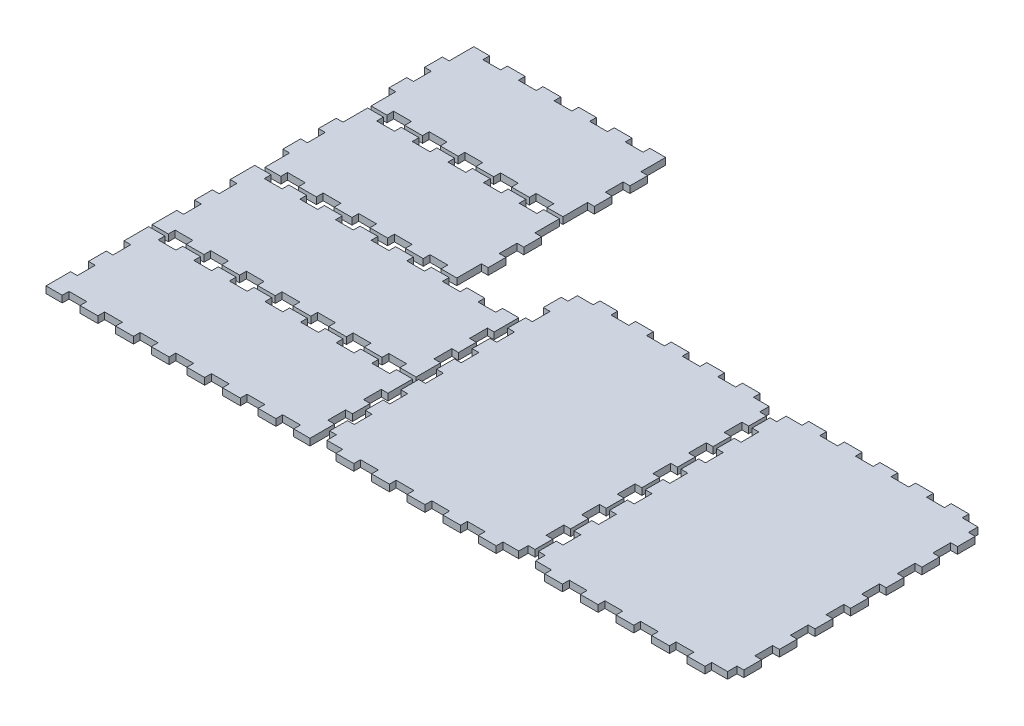
from build123d import *

# Parameters (mm, degrees)
BOSS_EXTRUDE1_DEPTH   = 5.842
BOSS_EXTRUDE1_2_DEPTH = 5.842
BOSS_EXTRUDE1_3_DEPTH = 5.842
BOSS_EXTRUDE1_4_DEPTH = 5.842
BOSS_EXTRUDE1_5_DEPTH = 5.842
BOSS_EXTRUDE1_6_DEPTH = 5.842


with BuildPart() as part:
    # Sketch4 → Boss-Extrude1 (new body)
    with BuildSketch(Plane(origin=(0, 0, 0), x_dir=(1, 0, 0), z_dir=(0, 1, 0))):
        Polygon((37.9222, 367.6142), (37.9222, 361.7722), (22.5044, 361.7722), (22.5044, 367.6142), (8.8392, 367.6142), (8.8392, 361.7722), (8.8392, 346.2782), (2.9972, 346.2782), (2.9972, 330.8604), (8.8392, 330.8604), (8.8392, 315.4426), (2.9972, 315.4426), (2.9972, 300.0248), (8.8392, 300.0248), (8.8392, 284.5308), (8.8392, 278.6888), (22.5044, 278.6888), (22.5044, 284.5308), (37.9222, 284.5308), (37.9222, 278.6888), (53.34, 278.6888), (53.34, 284.5308), (68.7578, 284.5308), (68.7578, 278.6888), (84.201, 278.6888), (84.201, 284.5308), (99.6188, 284.5308), (99.6188, 278.6888), (115.0366, 278.6888), (115.0366, 284.5308), (130.4544, 284.5308), (130.4544, 278.6888), (145.8722, 278.6888), (145.8722, 284.5308), (161.29, 284.5308), (161.29, 278.6888), (174.9552, 278.6888), (174.9552, 284.5308), (174.9552, 300.0248), (180.7972, 300.0248), (180.7972, 315.4426), (174.9552, 315.4426), (174.9552, 330.8604), (180.7972, 330.8604), (180.7972, 346.2782), (174.9552, 346.2782), (174.9552, 361.7722), (174.9552, 367.6142), (161.29, 367.6142), (161.29, 361.7722), (145.8722, 361.7722), (145.8722, 367.6142), (130.4544, 367.6142), (130.4544, 361.7722), (115.0366, 361.7722), (115.0366, 367.6142), (99.6188, 367.6142), (99.6188, 361.7722), (84.201, 361.7722), (84.201, 367.6142), (68.7578, 367.6142), (68.7578, 361.7722), (53.34, 361.7722), (53.34, 367.6142), align=None)
    extrude(amount=BOSS_EXTRUDE1_DEPTH)


with BuildPart() as body_2:
    # Sketch4 → Boss-Extrude1 2 (new body)
    with BuildSketch(Plane(origin=(0, 0, 0), x_dir=(1, 0, 0), z_dir=(0, 1, 0))):
        Polygon((180.7972, 223.5454), (174.9552, 223.5454), (174.9552, 238.9632), (180.7972, 238.9632), (180.7972, 254.381), (174.9552, 254.381), (174.9552, 269.8496), (174.9552, 275.6916), (161.29, 275.6916), (161.29, 269.8496), (145.8722, 269.8496), (145.8722, 275.6916), (130.4544, 275.6916), (130.4544, 269.8496), (115.0366, 269.8496), (115.0366, 275.6916), (99.6188, 275.6916), (99.6188, 269.8496), (84.201, 269.8496), (84.201, 275.6916), (68.7578, 275.6916), (68.7578, 269.8496), (53.34, 269.8496), (53.34, 275.6916), (37.9222, 275.6916), (37.9222, 269.8496), (22.5044, 269.8496), (22.5044, 275.6916), (8.8392, 275.6916), (8.8392, 269.8496), (8.8392, 254.381), (2.9972, 254.381), (2.9972, 238.9632), (8.8392, 238.9632), (8.8392, 223.5454), (2.9972, 223.5454), (2.9972, 208.1276), (8.8392, 208.1276), (8.8392, 192.6336), (8.8392, 186.7916), (22.5044, 186.7916), (22.5044, 192.6336), (37.9222, 192.6336), (37.9222, 186.7916), (53.34, 186.7916), (53.34, 192.6336), (68.7578, 192.6336), (68.7578, 186.7916), (84.201, 186.7916), (84.201, 192.6336), (99.6188, 192.6336), (99.6188, 186.7916), (115.0366, 186.7916), (115.0366, 192.6336), (130.4544, 192.6336), (130.4544, 186.7916), (145.8722, 186.7916), (145.8722, 192.6336), (161.29, 192.6336), (161.29, 186.7916), (174.9552, 186.7916), (174.9552, 192.6336), (174.9552, 208.1276), (180.7972, 208.1276), align=None)
    extrude(amount=BOSS_EXTRUDE1_2_DEPTH)


with BuildPart() as body_3:
    # Sketch4 → Boss-Extrude1 3 (new body)
    with BuildSketch(Plane(origin=(0, 0, 0), x_dir=(1, 0, 0), z_dir=(0, 1, 0))):
        Polygon((217.5256, 183.7944), (217.5256, 177.9524), (202.1078, 177.9524), (202.1078, 183.7944), (186.69, 183.7944), (186.69, 177.9524), (171.2722, 177.9524), (171.2722, 183.7944), (155.8544, 183.7944), (155.8544, 177.9524), (140.4366, 177.9524), (140.4366, 183.7944), (125.0188, 183.7944), (125.0188, 177.9524), (109.601, 177.9524), (109.601, 183.7944), (94.1578, 183.7944), (94.1578, 177.9524), (78.74, 177.9524), (78.74, 183.7944), (63.3222, 183.7944), (63.3222, 177.9524), (47.9044, 177.9524), (47.9044, 183.7944), (32.4866, 183.7944), (32.4866, 177.9524), (17.0688, 177.9524), (17.0688, 183.7944), (8.8392, 183.7944), (2.9972, 183.7944), (2.9972, 177.9524), (2.9972, 162.4838), (8.8392, 162.4838), (8.8392, 147.066), (2.9972, 147.066), (2.9972, 131.6482), (8.8392, 131.6482), (8.8392, 116.2304), (2.9972, 116.2304), (2.9972, 100.7364), (2.9972, 94.8944), (8.8392, 94.8944), (17.0688, 94.8944), (17.0688, 100.7364), (32.4866, 100.7364), (32.4866, 94.8944), (47.9044, 94.8944), (47.9044, 100.7364), (63.3222, 100.7364), (63.3222, 94.8944), (78.74, 94.8944), (78.74, 100.7364), (94.1578, 100.7364), (94.1578, 94.8944), (109.601, 94.8944), (109.601, 100.7364), (125.0188, 100.7364), (125.0188, 94.8944), (140.4366, 94.8944), (140.4366, 100.7364), (155.8544, 100.7364), (155.8544, 94.8944), (171.2722, 94.8944), (171.2722, 100.7364), (186.69, 100.7364), (186.69, 94.8944), (202.1078, 94.8944), (202.1078, 100.7364), (217.5256, 100.7364), (217.5256, 94.8944), (225.7552, 94.8944), (231.5972, 94.8944), (231.5972, 100.7364), (231.5972, 116.2304), (225.7552, 116.2304), (225.7552, 131.6482), (231.5972, 131.6482), (231.5972, 147.066), (225.7552, 147.066), (225.7552, 162.4838), (231.5972, 162.4838), (231.5972, 177.9524), (231.5972, 183.7944), (225.7552, 183.7944), align=None)
    extrude(amount=BOSS_EXTRUDE1_3_DEPTH)


with BuildPart() as body_4:
    # Sketch4 → Boss-Extrude1 4 (new body)
    with BuildSketch(Plane(origin=(0, 0, 0), x_dir=(1, 0, 0), z_dir=(0, 1, 0))):
        Polygon((155.8544, 91.8972), (155.8544, 86.0552), (140.4366, 86.0552), (140.4366, 91.8972), (125.0188, 91.8972), (125.0188, 86.0552), (109.601, 86.0552), (109.601, 91.8972), (94.1578, 91.8972), (94.1578, 86.0552), (78.74, 86.0552), (78.74, 91.8972), (63.3222, 91.8972), (63.3222, 86.0552), (47.9044, 86.0552), (47.9044, 91.8972), (32.4866, 91.8972), (32.4866, 86.0552), (17.0688, 86.0552), (17.0688, 91.8972), (8.8392, 91.8972), (2.9972, 91.8972), (2.9972, 86.0552), (2.9972, 70.5866), (8.8392, 70.5866), (8.8392, 55.1688), (2.9972, 55.1688), (2.9972, 39.751), (8.8392, 39.751), (8.8392, 24.3078), (2.9972, 24.3078), (2.9972, 8.8392), (2.9972, 2.9972), (8.8392, 2.9972), (17.0688, 2.9972), (17.0688, 8.8392), (32.4866, 8.8392), (32.4866, 2.9972), (47.9044, 2.9972), (47.9044, 8.8392), (63.3222, 8.8392), (63.3222, 2.9972), (78.74, 2.9972), (78.74, 8.8392), (94.1578, 8.8392), (94.1578, 2.9972), (109.601, 2.9972), (109.601, 8.8392), (125.0188, 8.8392), (125.0188, 2.9972), (140.4366, 2.9972), (140.4366, 8.8392), (155.8544, 8.8392), (155.8544, 2.9972), (171.2722, 2.9972), (171.2722, 8.8392), (186.69, 8.8392), (186.69, 2.9972), (202.1078, 2.9972), (202.1078, 8.8392), (217.5256, 8.8392), (217.5256, 2.9972), (225.7552, 2.9972), (231.5972, 2.9972), (231.5972, 8.8392), (231.5972, 24.3078), (225.7552, 24.3078), (225.7552, 39.751), (231.5972, 39.751), (231.5972, 55.1688), (225.7552, 55.1688), (225.7552, 70.5866), (231.5972, 70.5866), (231.5972, 86.0552), (231.5972, 91.8972), (225.7552, 91.8972), (217.5256, 91.8972), (217.5256, 86.0552), (202.1078, 86.0552), (202.1078, 91.8972), (186.69, 91.8972), (186.69, 86.0552), (171.2722, 86.0552), (171.2722, 91.8972), align=None)
    extrude(amount=BOSS_EXTRUDE1_4_DEPTH)


with BuildPart() as body_5:
    # Sketch4 → Boss-Extrude1 5 (new body)
    with BuildSketch(Plane(origin=(0, 0, 0), x_dir=(1, 0, 0), z_dir=(0, 1, 0))):
        Polygon((284.9372, 231.5972), (284.9372, 225.7552), (269.5194, 225.7552), (269.5194, 231.5972), (254.1016, 231.5972), (254.1016, 225.7552), (240.4364, 225.7552), (240.4364, 217.5256), (234.5944, 217.5256), (234.5944, 202.1078), (240.4364, 202.1078), (240.4364, 186.69), (234.5944, 186.69), (234.5944, 171.2722), (240.4364, 171.2722), (240.4364, 155.8544), (234.5944, 155.8544), (234.5944, 140.4366), (240.4364, 140.4366), (240.4364, 125.0188), (234.5944, 125.0188), (234.5944, 109.601), (240.4364, 109.601), (240.4364, 94.1578), (234.5944, 94.1578), (234.5944, 78.74), (240.4364, 78.74), (240.4364, 63.3222), (234.5944, 63.3222), (234.5944, 47.9044), (240.4364, 47.9044), (240.4364, 32.4866), (234.5944, 32.4866), (234.5944, 17.0688), (240.4364, 17.0688), (240.4364, 8.8392), (254.1016, 8.8392), (254.1016, 2.9972), (269.5194, 2.9972), (269.5194, 8.8392), (284.9372, 8.8392), (284.9372, 2.9972), (300.3804, 2.9972), (300.3804, 8.8392), (315.7982, 8.8392), (315.7982, 2.9972), (331.216, 2.9972), (331.216, 8.8392), (346.6338, 8.8392), (346.6338, 2.9972), (362.0516, 2.9972), (362.0516, 8.8392), (377.4694, 8.8392), (377.4694, 2.9972), (392.8872, 2.9972), (392.8872, 8.8392), (406.5524, 8.8392), (406.5524, 17.0688), (412.3944, 17.0688), (412.3944, 32.4866), (406.5524, 32.4866), (406.5524, 47.9044), (412.3944, 47.9044), (412.3944, 63.3222), (406.5524, 63.3222), (406.5524, 78.74), (412.3944, 78.74), (412.3944, 94.1578), (406.5524, 94.1578), (406.5524, 109.601), (412.3944, 109.601), (412.3944, 125.0188), (406.5524, 125.0188), (406.5524, 140.4366), (412.3944, 140.4366), (412.3944, 155.8544), (406.5524, 155.8544), (406.5524, 171.2722), (412.3944, 171.2722), (412.3944, 186.69), (406.5524, 186.69), (406.5524, 202.1078), (412.3944, 202.1078), (412.3944, 217.5256), (406.5524, 217.5256), (406.5524, 225.7552), (392.8872, 225.7552), (392.8872, 231.5972), (377.4694, 231.5972), (377.4694, 225.7552), (362.0516, 225.7552), (362.0516, 231.5972), (346.6338, 231.5972), (346.6338, 225.7552), (331.216, 225.7552), (331.216, 231.5972), (315.7982, 231.5972), (315.7982, 225.7552), (300.3804, 225.7552), (300.3804, 231.5972), align=None)
    extrude(amount=BOSS_EXTRUDE1_5_DEPTH)


with BuildPart() as body_6:
    # Sketch4 → Boss-Extrude1 6 (new body)
    with BuildSketch(Plane(origin=(0, 0, 0), x_dir=(1, 0, 0), z_dir=(0, 1, 0))):
        Polygon((465.7598, 231.5972), (465.7598, 225.7552), (450.3166, 225.7552), (450.3166, 231.5972), (434.8988, 231.5972), (434.8988, 225.7552), (421.2336, 225.7552), (421.2336, 217.5256), (415.3916, 217.5256), (415.3916, 202.1078), (421.2336, 202.1078), (421.2336, 186.69), (415.3916, 186.69), (415.3916, 171.2722), (421.2336, 171.2722), (421.2336, 155.8544), (415.3916, 155.8544), (415.3916, 140.4366), (421.2336, 140.4366), (421.2336, 125.0188), (415.3916, 125.0188), (415.3916, 109.601), (421.2336, 109.601), (421.2336, 94.1578), (415.3916, 94.1578), (415.3916, 78.74), (421.2336, 78.74), (421.2336, 63.3222), (415.3916, 63.3222), (415.3916, 47.9044), (421.2336, 47.9044), (421.2336, 32.4866), (415.3916, 32.4866), (415.3916, 17.0688), (421.2336, 17.0688), (421.2336, 8.8392), (434.8988, 8.8392), (434.8988, 2.9972), (450.3166, 2.9972), (450.3166, 8.8392), (465.7598, 8.8392), (465.7598, 2.9972), (481.1776, 2.9972), (481.1776, 8.8392), (496.5954, 8.8392), (496.5954, 2.9972), (512.0132, 2.9972), (512.0132, 8.8392), (527.431, 8.8392), (527.431, 2.9972), (542.8488, 2.9972), (542.8488, 8.8392), (558.2666, 8.8392), (558.2666, 2.9972), (573.6844, 2.9972), (573.6844, 8.8392), (587.3496, 8.8392), (587.3496, 17.0688), (593.1916, 17.0688), (593.1916, 32.4866), (587.3496, 32.4866), (587.3496, 47.9044), (593.1916, 47.9044), (593.1916, 63.3222), (587.3496, 63.3222), (587.3496, 78.74), (593.1916, 78.74), (593.1916, 94.1578), (587.3496, 94.1578), (587.3496, 109.601), (593.1916, 109.601), (593.1916, 125.0188), (587.3496, 125.0188), (587.3496, 140.4366), (593.1916, 140.4366), (593.1916, 155.8544), (587.3496, 155.8544), (587.3496, 171.2722), (593.1916, 171.2722), (593.1916, 186.69), (587.3496, 186.69), (587.3496, 202.1078), (593.1916, 202.1078), (593.1916, 217.5256), (587.3496, 217.5256), (587.3496, 225.7552), (573.6844, 225.7552), (573.6844, 231.5972), (558.2666, 231.5972), (558.2666, 225.7552), (542.8488, 225.7552), (542.8488, 231.5972), (527.431, 231.5972), (527.431, 225.7552), (512.0132, 225.7552), (512.0132, 231.5972), (496.5954, 231.5972), (496.5954, 225.7552), (481.1776, 225.7552), (481.1776, 231.5972), align=None)
    extrude(amount=BOSS_EXTRUDE1_6_DEPTH)


solid = Compound([part.part, body_2.part, body_3.part, body_4.part, body_5.part, body_6.part])
